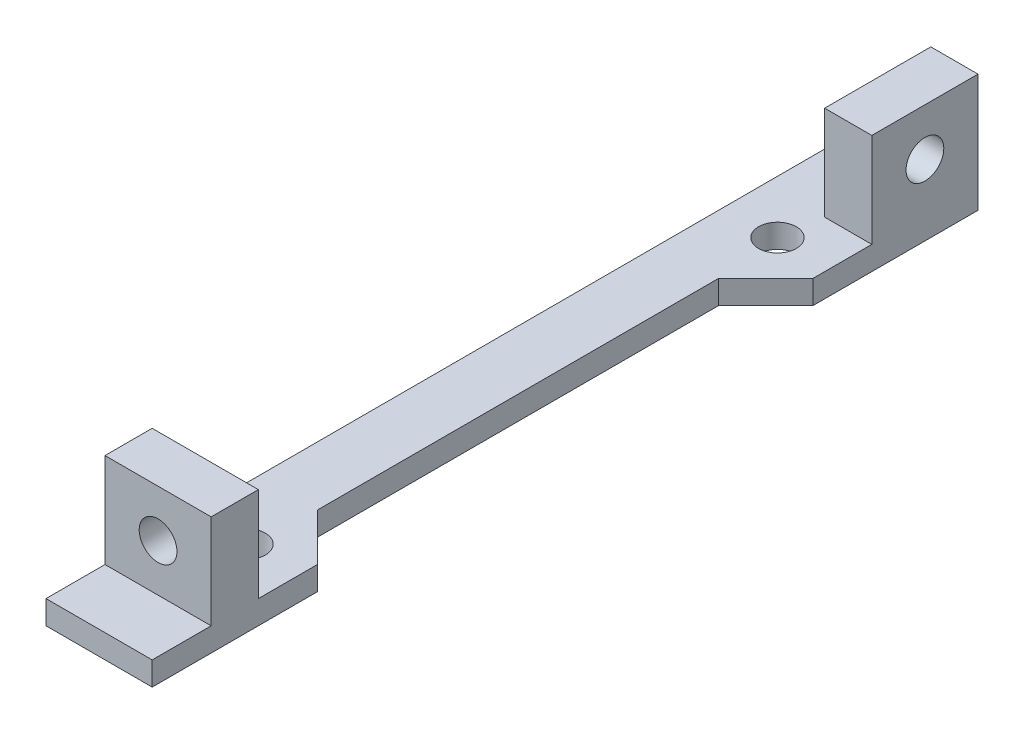
from build123d import *

# Parameters (mm, degrees)
ESBO_O6_W                = 9
ESBO_O6_H                = 70
RESSALTO_EXTRUS_O5_DEPTH = 2
ESBO_O7_W                = 9
ESBO_O7_H                = 4
ESBO_O7_W_2              = 4
ESBO_O7_H_2              = 9
RESSALTO_EXTRUS_O6_DEPTH = 8
ESBO_O8_R                = 1.6
CORTE_EXTRUS_O4_DEPTH    = 5
ESBO_O9_R                = 1.6
CORTE_EXTRUS_O5_DEPTH    = 5
CORTE_EXTRUS_O8_DEPTH    = 37.183559803
ESBO_O12_R               = 1.6
CORTE_EXTRUS_O9_DEPTH    = 5


with BuildPart() as part:
    # Esboço6 → Ressalto-extrusão5 (new body)
    with BuildSketch(Plane(origin=(0, 0, 0), x_dir=(1, 0, 0), z_dir=(0, 1, 0))):
        Rectangle(ESBO_O6_W, ESBO_O6_H)
    extrude(amount=RESSALTO_EXTRUS_O5_DEPTH)

    # Esboço7 → Ressalto-extrusão6 (add)
    with BuildSketch(Plane(origin=(0, 2, 0), x_dir=(1, 0, 0), z_dir=(0, 1, 0))):
        with Locations((0, -28)):
            Rectangle(ESBO_O7_W, ESBO_O7_H)
        with Locations((2.5, 30.5)):
            Rectangle(ESBO_O7_W_2, ESBO_O7_H_2)
    extrude(amount=RESSALTO_EXTRUS_O6_DEPTH)

    # Esboço8 → Corte-extrusão4 (cut)
    with BuildSketch(Plane.XY.offset(30)):
        with Locations((0, 6)):
            Circle(ESBO_O8_R)
    extrude(amount=-CORTE_EXTRUS_O4_DEPTH, mode=Mode.SUBTRACT)

    # Esboço9 → Corte-extrusão5 (cut)
    with BuildSketch(Plane(origin=(4.5, 0, 0), x_dir=(0, 0, -1), z_dir=(1, 0, 0))):
        with Locations((30.5, 6)):
            Circle(ESBO_O9_R)
    extrude(amount=-CORTE_EXTRUS_O5_DEPTH, mode=Mode.SUBTRACT)

    # Esboço10 → Corte-extrusão8 (cut, through all)
    with BuildSketch(Plane(origin=(0, 2, 0), x_dir=(1, 0, 0), z_dir=(0, 1, 0))):
        Polygon((4.5, 21), (0.5, 17), (0.5, -17), (4.5, -21), align=None)
    extrude(amount=-CORTE_EXTRUS_O8_DEPTH, mode=Mode.SUBTRACT)

    # Esboço12 → Corte-extrusão9 (cut)
    with BuildSketch(Plane(origin=(0, 2, 0), x_dir=(1, 0, 0), z_dir=(0, 1, 0))):
        with Locations(Location((0, 22.5, 0), (0, 0, 270))):
            Circle(ESBO_O12_R)
        with Locations(Location((0, -22.5, 0), (0, 0, 270))):
            Circle(ESBO_O12_R)
    extrude(amount=-CORTE_EXTRUS_O9_DEPTH, mode=Mode.SUBTRACT)


solid = part.part
